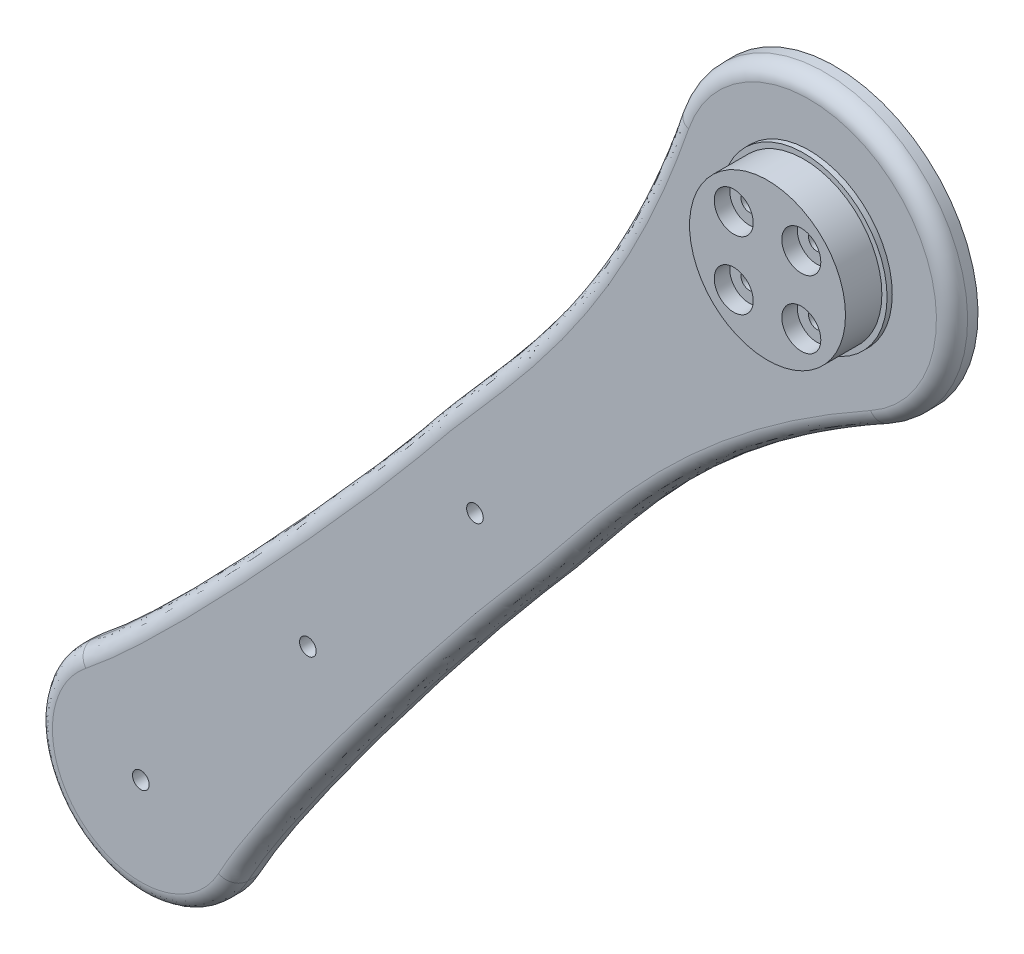
from build123d import *

# Parameters (mm, degrees)
SKETCH1_R           = 1.6
BOSS_EXTRUDE1_DEPTH = 5
SKETCH2_R           = 16
SKETCH2_R_2         = 1.6
BOSS_EXTRUDE2_DEPTH = 1
SKETCH3_R           = 15
SKETCH3_R_2         = 1.6
BOSS_EXTRUDE3_DEPTH = 7
SKETCH4_R           = 3.75
CUT_EXTRUDE1_DEPTH  = 3
VARFILLET1_R        = 3


with BuildPart() as part:
    # Sketch1 → Boss-Extrude1 (new body)
    with BuildSketch(Plane.XY.offset(31)):
        with BuildLine():
            ThreePointArc((155.019115612, -142.985112199), (159.394881243, -97.849485606), (115.704809966, -109.996492831))
            add(Edge.make_bspline(
                [(115.704809966, -109.996492831), (101.94879758, -150.116707379), (78.178790791, -171.772825461), (58.717079478, -197.082387325), (16.356999542, -244.049515564), (0.72448619, -256.46124476)],
                knots=[0, 0, 0, 0, 0.619090324, 0.719090324, 1, 1, 1, 1], degree=3))
            ThreePointArc((0.72448619, -256.46124476), (0.304947846, -287.445485278), (30.74561606, -281.651963762))
            add(Edge.make_bspline(
                [(155.019115612, -142.985112199), (117.897123756, -163.498941991), (100.69762913, -190.668374405), (79.152067085, -214.229377889), (40.254225745, -264.101669257), (30.74561606, -281.651963762)],
                knots=[0, 0, 0, 0, 0.619090324, 0.719090324, 1, 1, 1, 1], degree=3))
        make_face()
        with Locations((135.218221977, -112.415707792)):
            Circle(SKETCH1_R, mode=Mode.SUBTRACT)
        with Locations((148.218221977, -112.415707792)):
            Circle(SKETCH1_R, mode=Mode.SUBTRACT)
        with Locations((148.218221977, -125.415707792)):
            Circle(SKETCH1_R, mode=Mode.SUBTRACT)
        with Locations((135.218221977, -125.415707792)):
            Circle(SKETCH1_R, mode=Mode.SUBTRACT)
        with Locations((77.439461008, -195.520152104)):
            Circle(SKETCH1_R, mode=Mode.SUBTRACT)
        with Locations((45.300080524, -233.82237426)):
            Circle(SKETCH1_R, mode=Mode.SUBTRACT)
        with Locations((13.16070004, -272.124596416)):
            Circle(SKETCH1_R, mode=Mode.SUBTRACT)
    extrude(amount=BOSS_EXTRUDE1_DEPTH)

    # Sketch2 → Boss-Extrude2 (add)
    with BuildSketch(Plane.XY.offset(36)):
        with Locations((141.718221977, -118.915707792)):
            Circle(SKETCH2_R)
        with Locations((135.218221977, -125.415707792)):
            Circle(SKETCH2_R_2, mode=Mode.SUBTRACT)
        with Locations((148.218221977, -125.415707792)):
            Circle(SKETCH2_R_2, mode=Mode.SUBTRACT)
        with Locations((135.218221977, -112.415707792)):
            Circle(SKETCH2_R_2, mode=Mode.SUBTRACT)
        with Locations((148.218221977, -112.415707792)):
            Circle(SKETCH2_R_2, mode=Mode.SUBTRACT)
    extrude(amount=BOSS_EXTRUDE2_DEPTH)

    # Sketch3 → Boss-Extrude3 (add)
    with BuildSketch(Plane.XY.offset(37)):
        with Locations((141.718221977, -118.915707792)):
            Circle(SKETCH3_R)
        with Locations((135.218221977, -125.415707792)):
            Circle(SKETCH3_R_2, mode=Mode.SUBTRACT)
        with Locations((148.218221977, -125.415707792)):
            Circle(SKETCH3_R_2, mode=Mode.SUBTRACT)
        with Locations((135.218221977, -112.415707792)):
            Circle(SKETCH3_R_2, mode=Mode.SUBTRACT)
        with Locations((148.218221977, -112.415707792)):
            Circle(SKETCH3_R_2, mode=Mode.SUBTRACT)
    extrude(amount=BOSS_EXTRUDE3_DEPTH)

    # Sketch4 → Cut-Extrude1 (cut)
    with BuildSketch(Plane.XY.offset(44)):
        with Locations((135.218221977, -112.415707792)):
            Circle(SKETCH4_R)
        with Locations((148.218221977, -112.415707792)):
            Circle(SKETCH4_R)
        with Locations((148.218221977, -125.415707792)):
            Circle(SKETCH4_R)
        with Locations((135.218221977, -125.415707792)):
            Circle(SKETCH4_R)
    extrude(amount=-CUT_EXTRUDE1_DEPTH, mode=Mode.SUBTRACT)

    # VarFillet1
    varfillet1_edges = [part.edges().sort_by_distance(p)[0] for p in [
        (0.304947846, -287.445485278, 36),
        (65.360846316, -188.427744165, 36),
        (86.521548764, -206.183681785, 36),
    ]]
    fillet(varfillet1_edges, radius=VARFILLET1_R)


solid = part.part
